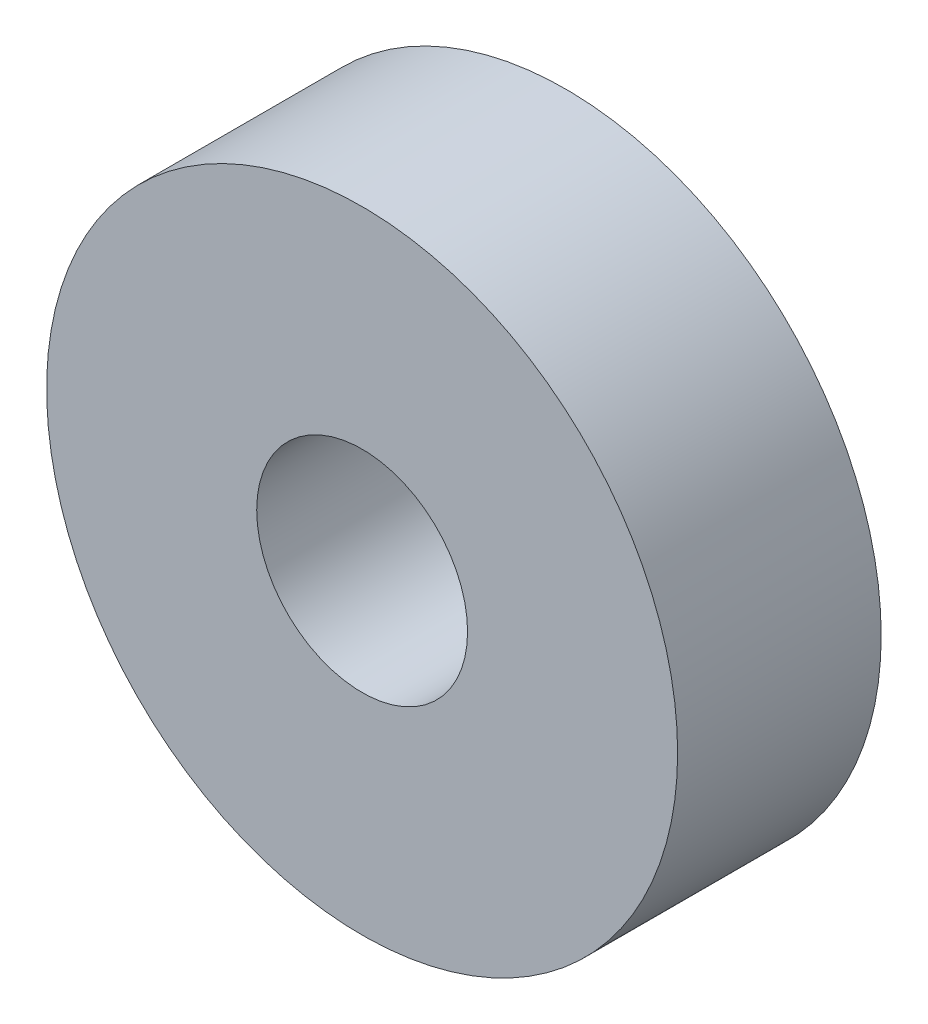
from build123d import *

# Parameters (mm, degrees)
SKETCH1_R           = 7.75
SKETCH1_R_2         = 2.59
BOSS_EXTRUDE1_DEPTH = 5
SKETCH2_R           = 6.5
SKETCH2_R_2         = 3.5
CUT_EXTRUDE1_DEPTH  = 2


with BuildPart() as part:
    # Sketch1 → Boss-Extrude1 (new body)
    with BuildSketch(Plane.XY):
        Circle(SKETCH1_R)
        Circle(SKETCH1_R_2, mode=Mode.SUBTRACT)
    extrude(amount=BOSS_EXTRUDE1_DEPTH)

    # Sketch2 → Cut-Extrude1 (cut)
    with BuildSketch(Plane(origin=(0, 0, 0), x_dir=(-1, 0, 0), z_dir=(0, 0, -1))):
        Circle(SKETCH2_R)
        Circle(SKETCH2_R_2, mode=Mode.SUBTRACT)
    extrude(amount=-CUT_EXTRUDE1_DEPTH, mode=Mode.SUBTRACT)


solid = part.part
